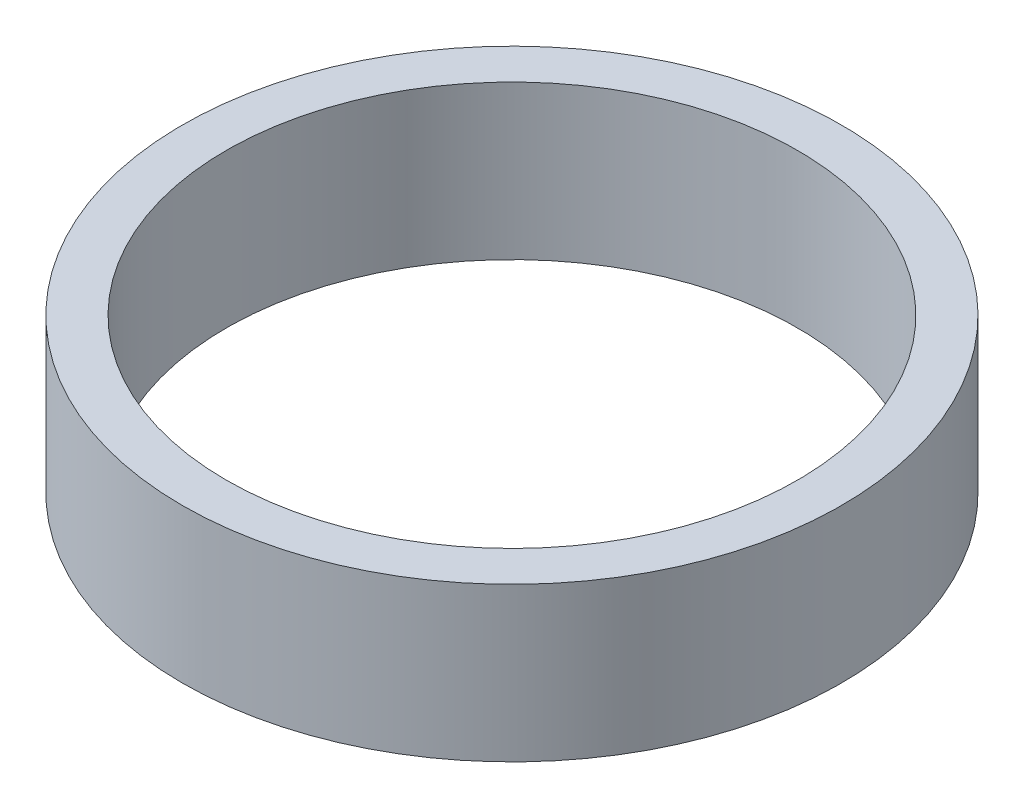
from build123d import *

# Parameters (mm, degrees)
IZIM1_R                     = 150
IZIM1_R_2                   = 130
Y_KSEKLIK_EKSTR_ZYON1_DEPTH = 70


with BuildPart() as part:
    # Çizim1 → Yükseklik-Ekstrüzyon1 (new body)
    with BuildSketch(Plane(origin=(0, 0, 0), x_dir=(1, 0, 0), z_dir=(0, 1, 0))):
        with Locations(Location((0, 0, 0), (0, 0, 270))):
            Circle(IZIM1_R)
        with Locations(Location((0, 0, 0), (0, 0, 270))):
            Circle(IZIM1_R_2, mode=Mode.SUBTRACT)
    extrude(amount=Y_KSEKLIK_EKSTR_ZYON1_DEPTH)


solid = part.part
